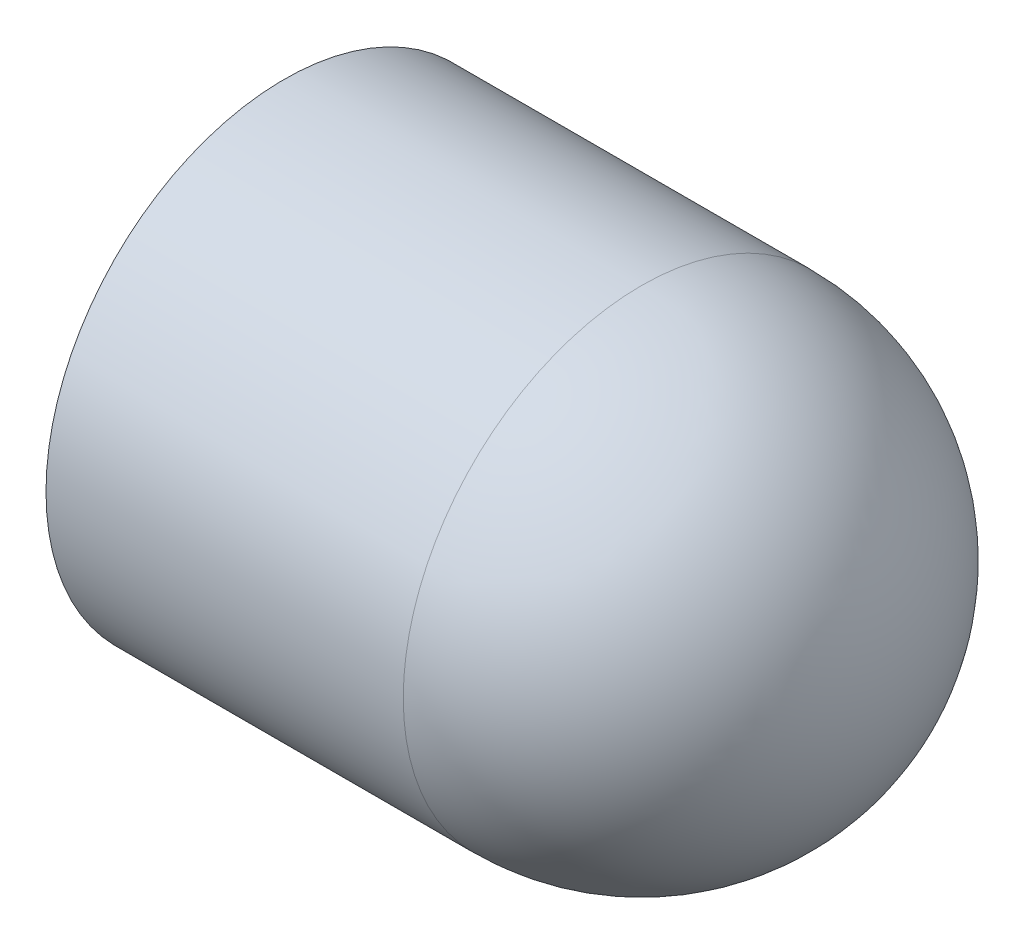
from build123d import *


with BuildPart() as part:
    # Эскиз1 → Повернуть1 (revolve)
    with BuildSketch(Plane.XY):
        with BuildLine():
            Line((12.5, 0), (26.858898944, 0))
            ThreePointArc((26.858898944, 0), (24.662199802, 5.303300859), (19.358898944, 7.5))
            Line((19.358898944, 7.5), (10, 7.5))
            ThreePointArc((10, 7.5), (11.858541226, 3.952847075), (12.5, 0))
        make_face()
        with BuildLine():
            Line((19.358898944, 10), (4.358898944, 10))
            Line((4.358898944, 10), (4.358898944, 9))
            ThreePointArc((4.358898944, 9), (8.473163206, 5.310885546), (10, 0))
            Line((10, 0), (12.5, 0))
            ThreePointArc((12.5, 0), (11.858541226, 3.952847075), (10, 7.5))
            Line((10, 7.5), (19.358898944, 7.5))
            ThreePointArc((19.358898944, 7.5), (24.662199802, 5.303300859), (26.858898944, 0))
            Line((26.858898944, 0), (29.358898944, 0))
            ThreePointArc((29.358898944, 0), (26.429966755, 7.071067812), (19.358898944, 10))
        make_face()
    revolve(axis=Axis((10, 0, 0), (1, 0, 0)))


solid = part.part
